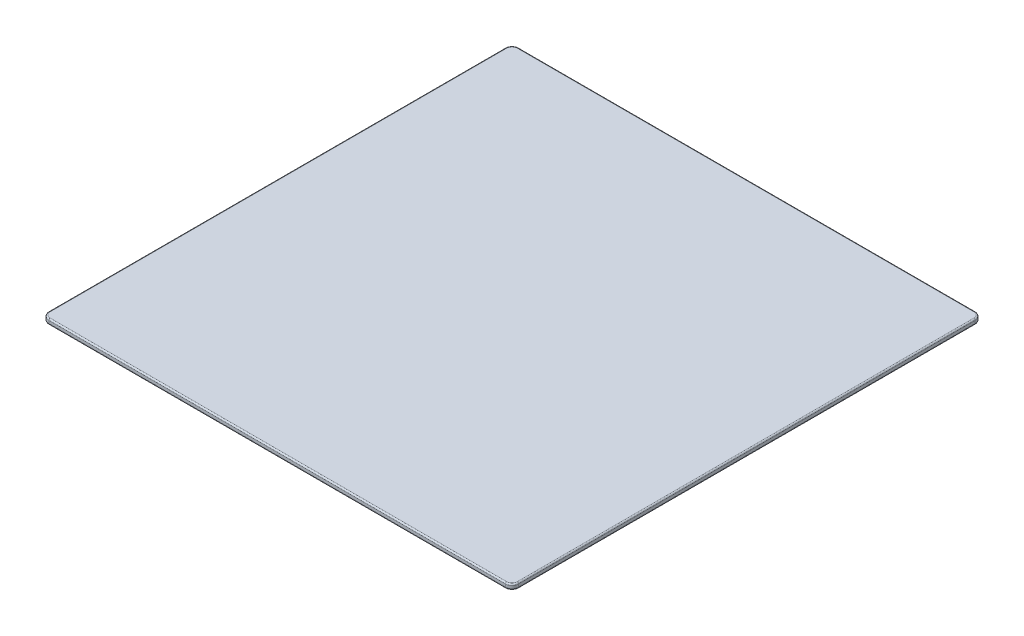
from build123d import *

# Parameters (mm, degrees)
BOSS_EXTRUDE1_DEPTH = 4
FILLET1_R           = 1


with BuildPart() as part:
    # Sketch1 → Boss-Extrude1 (new body)
    with BuildSketch(Plane(origin=(0, 0, 0), x_dir=(1, 0, 0), z_dir=(0, 1, 0))):
        with BuildLine():
            Line((-170, 175), (170, 175))
            ThreePointArc((170, 175), (173.535533906, 173.535533906), (175, 170))
            Line((175, 170), (175, -170))
            ThreePointArc((175, -170), (173.535533906, -173.535533906), (170, -175))
            Line((170, -175), (-170, -175))
            ThreePointArc((-170, -175), (-173.535533906, -173.535533906), (-175, -170))
            Line((-175, -170), (-175, 170))
            ThreePointArc((-175, 170), (-173.535533906, 173.535533906), (-170, 175))
        make_face()
    extrude(amount=BOSS_EXTRUDE1_DEPTH)

    # Fillet1
    fillet1_edges = [part.edges().sort_by_distance(p)[0] for p in [
        (0, 0, -175),
        (173.535533906, 0, -173.535533906),
        (175, 0, 0),
        (173.535533906, 0, 173.535533906),
        (173.535533906, 4, -173.535533906),
        (0, 4, -175),
        (-173.535533906, 4, -173.535533906),
        (-175, 4, 0),
        (-173.535533906, 4, 173.535533906),
        (0, 4, 175),
        (173.535533906, 4, 173.535533906),
        (0, 0, 175),
        (175, 4, 0),
        (-173.535533906, 0, 173.535533906),
        (-175, 0, 0),
        (-173.535533906, 0, -173.535533906),
    ]]
    fillet(fillet1_edges, radius=FILLET1_R)


solid = part.part
